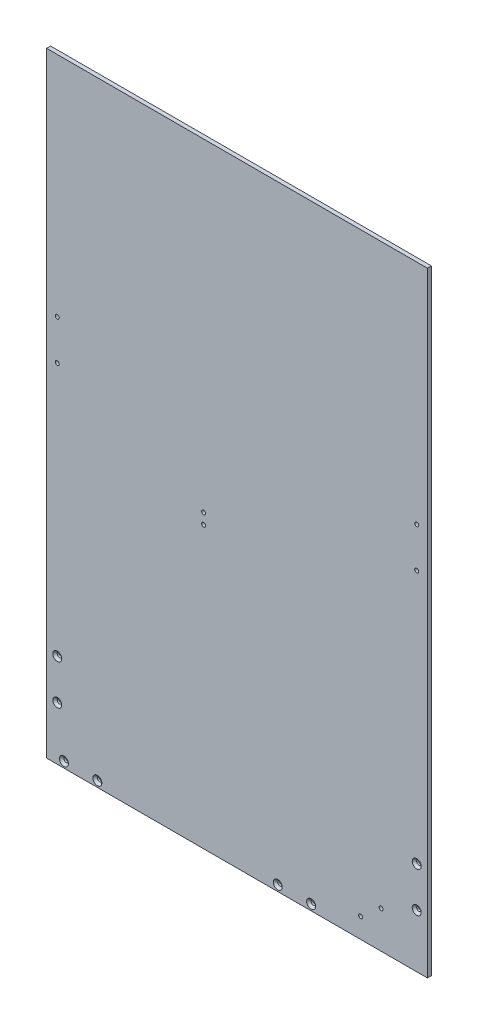
from build123d import *

# Parameters (mm, degrees)
SKETCH_1_W                  = 285
SKETCH_1_H                  = 460
EXTRUDE_1_DEPTH             = 3
SKETCH_2_R                  = 1.5
CUT_EXTRUDE_1_DEPTH         = 271.583166513
SKETCH_4_R                  = 1.5
CUT_EXTRUDE_2_DEPTH         = 271.583166513
SKETCH_6_R                  = 1.5
CUT_EXTRUDE_3_DEPTH         = 271.583166513
SKETCH_8_R                  = 1.5
CUT_EXTRUDE_5_DEPTH         = 271.583166513
HOLE_WIZARD_M3_1_AT_2_COUNT = 2
HOLE_WIZARD_M3_1_AT_2_PITCH = 30
HOLE_WIZARD_M3_1_AT_3_COUNT = 2
HOLE_WIZARD_M3_1_AT_3_PITCH = 269
HOLE_WIZARD_M3_1_AT_4_COUNT = 2
HOLE_WIZARD_M3_1_AT_4_PITCH = 270.667692937
HOLE_WIZARD_M3_1_AT_5_COUNT = 2
HOLE_WIZARD_M3_1_AT_5_PITCH = 65.690562488
HOLE_WIZARD_M3_1_AT_6_COUNT = 2
HOLE_WIZARD_M3_1_AT_6_PITCH = 72.043389704
HOLE_WIZARD_M3_1_AT_7_COUNT = 2
HOLE_WIZARD_M3_1_AT_7_PITCH = 177.525350302
HOLE_WIZARD_M3_1_AT_8_COUNT = 2
HOLE_WIZARD_M3_1_AT_8_PITCH = 200.973256927


with BuildPart() as part:
    # 草图1 → 凸台-拉伸1 (new body)
    with BuildSketch(Plane.XY):
        Rectangle(SKETCH_1_W, SKETCH_1_H)
    extrude(amount=EXTRUDE_1_DEPTH)

    # 草图2 → 切除-拉伸1 (cut, through all)
    with BuildSketch(Plane.XY.offset(3)):
        with Locations((-134.5, -190)):
            Circle(SKETCH_2_R)
        with Locations(Location((134.5, -190, 0), (0, 0, 180))):
            Circle(SKETCH_2_R)
        with Locations((-134.5, -160)):
            Circle(SKETCH_2_R)
        with Locations(Location((134.5, -160, 0), (0, 0, 180))):
            Circle(SKETCH_2_R)
        with Locations((-134.5, 30)):
            Circle(SKETCH_2_R)
        with Locations(Location((134.5, 30, 0), (0, 0, 180))):
            Circle(SKETCH_2_R)
        with Locations((-134.5, 60)):
            Circle(SKETCH_2_R)
        with Locations(Location((134.5, 60, 0), (0, 0, 180))):
            Circle(SKETCH_2_R)
    extrude(amount=-CUT_EXTRUDE_1_DEPTH, mode=Mode.SUBTRACT)

    # 草图4 → 切除-拉伸2 (cut, through all)
    with BuildSketch(Plane.XY.offset(3)):
        with Locations((-129.5, -225.5)):
            Circle(SKETCH_4_R)
        with Locations((-104.5, -225.5)):
            Circle(SKETCH_4_R)
        with Locations(Location((30.5, -225.5, 0), (0, 0, 180))):
            Circle(SKETCH_4_R)
        with Locations(Location((55.5, -225.5, 0), (0, 0, 180))):
            Circle(SKETCH_4_R)
    extrude(amount=-CUT_EXTRUDE_2_DEPTH, mode=Mode.SUBTRACT)

    # 草图6 → 切除-拉伸3 (cut, through all)
    with BuildSketch(Plane(origin=(0, 0, 0), x_dir=(-1, 0, 0), z_dir=(0, 0, -1))):
        with Locations((25, -20)):
            Circle(SKETCH_6_R)
        with Locations((25, -12)):
            Circle(SKETCH_6_R)
    extrude(amount=-CUT_EXTRUDE_3_DEPTH, mode=Mode.SUBTRACT)

    # 草图8 → 切除-拉伸5 (cut, through all)
    with BuildSketch(Plane(origin=(0, 0, 0), x_dir=(-1, 0, 0), z_dir=(0, 0, -1))):
        with Locations(Location((-107.820888862, -202.144247806, 0), (0, 0, 180))):
            Circle(SKETCH_8_R)
        with Locations(Location((-92.5, -215, 0), (0, 0, 180))):
            Circle(SKETCH_8_R)
    extrude(amount=-CUT_EXTRUDE_5_DEPTH, mode=Mode.SUBTRACT)

    # 草图9 → M3 六角凹锥坑螺钉的锥形沉头孔1 (revolve, cut)
    with BuildSketch(Plane(origin=(-134.5, -160, 3), x_dir=(0, -1, 0), z_dir=(1, 0, 0))):
        Polygon((0, 0), (0, 3), (1.7, 3), (1.7, 1.66), (3.36, 0), align=None)
    hole_wizard_m3_1 = revolve(axis=Axis((-134.5, -160, 9.35), (0, 0, -1)), mode=Mode.SUBTRACT)

    # M3 六角凹锥坑螺钉的锥形沉头孔1 at 2: M3 六角凹锥坑螺钉的锥形沉头孔1 ×2
    with Locations(*[(0, -i * HOLE_WIZARD_M3_1_AT_2_PITCH, 0) for i in range(1, HOLE_WIZARD_M3_1_AT_2_COUNT)]):
        add(hole_wizard_m3_1, mode=Mode.SUBTRACT)

    # M3 六角凹锥坑螺钉的锥形沉头孔1 at 3: M3 六角凹锥坑螺钉的锥形沉头孔1 ×2
    with Locations(*[(i * HOLE_WIZARD_M3_1_AT_3_PITCH, 0, 0) for i in range(1, HOLE_WIZARD_M3_1_AT_3_COUNT)]):
        add(hole_wizard_m3_1, mode=Mode.SUBTRACT)

    # M3 六角凹锥坑螺钉的锥形沉头孔1 at 4: M3 六角凹锥坑螺钉的锥形沉头孔1 ×2
    with Locations(*[Vector(0.993838596253579, -0.11083701816954397, 0) * (i * HOLE_WIZARD_M3_1_AT_4_PITCH) for i in range(1, HOLE_WIZARD_M3_1_AT_4_COUNT)]):
        add(hole_wizard_m3_1, mode=Mode.SUBTRACT)

    # M3 六角凹锥坑螺钉的锥形沉头孔1 at 5: M3 六角凹锥坑螺钉的锥形沉头孔1 ×2
    with Locations(*[Vector(0.0761144342599819, -0.997099088805763, 0) * (i * HOLE_WIZARD_M3_1_AT_5_PITCH) for i in range(1, HOLE_WIZARD_M3_1_AT_5_COUNT)]):
        add(hole_wizard_m3_1, mode=Mode.SUBTRACT)

    # M3 六角凹锥坑螺钉的锥形沉头孔1 at 6: M3 六角凹锥坑螺钉的锥形沉头孔1 ×2
    with Locations(*[Vector(0.41641572007343935, -0.909174322160343, 0) * (i * HOLE_WIZARD_M3_1_AT_6_PITCH) for i in range(1, HOLE_WIZARD_M3_1_AT_6_COUNT)]):
        add(hole_wizard_m3_1, mode=Mode.SUBTRACT)

    # M3 六角凹锥坑螺钉的锥形沉头孔1 at 7: M3 六角凹锥坑螺钉的锥形沉头孔1 ×2
    with Locations(*[Vector(0.9294447227897835, -0.36896138995594435, 0) * (i * HOLE_WIZARD_M3_1_AT_7_PITCH) for i in range(1, HOLE_WIZARD_M3_1_AT_7_COUNT)]):
        add(hole_wizard_m3_1, mode=Mode.SUBTRACT)

    # M3 六角凹锥坑螺钉的锥形沉头孔1 at 8: M3 六角凹锥坑螺钉的锥形沉头孔1 ×2
    with Locations(*[Vector(0.9453994173396505, -0.32591400966182693, 0) * (i * HOLE_WIZARD_M3_1_AT_8_PITCH) for i in range(1, HOLE_WIZARD_M3_1_AT_8_COUNT)]):
        add(hole_wizard_m3_1, mode=Mode.SUBTRACT)


solid = part.part
